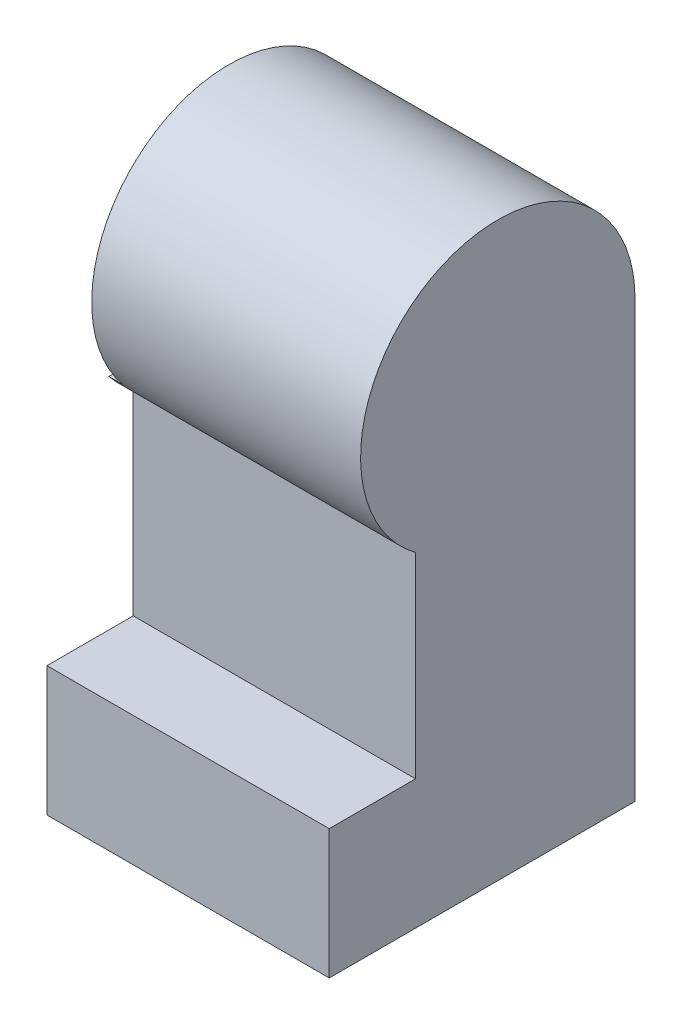
from build123d import *

# Parameters (mm, degrees)
SALIENTE_EXTRUIR1_DEPTH    = 10.8
CORTAR_EXTRUIR1_DEPTH      = 28.076558127
CORTAR_EXTRUIR1_DEPTH_BACK = 28.076558127
CROQUIS4_W                 = 1.025
CROQUIS4_H                 = 17.1
CORTAR_EXTRUIR2_DEPTH      = 33.246404838
CORTAR_EXTRUIR2_DEPTH_BACK = 5.4
CROQUIS5_R                 = 3


with BuildPart() as part:
    # Croquis2 → Saliente-Extruir1 (new, symmetric)
    with BuildSketch(Plane(origin=(0, 0, 0), x_dir=(0, 0, -1), z_dir=(1, 0, 0))):
        with BuildLine():
            Line((11.7, 11.4), (11.7, -21.9))
            Line((11.7, -21.9), (-11.7, -21.9))
            Line((-11.7, -21.9), (-11.7, -12))
            Line((-11.7, -12), (-5.1, -12))
            Line((-5.1, -12), (-5.1, 3))
            ThreePointArc((-5.1, 3), (-3.495742753, 20.791485505), (11.7, 11.4))
        make_face()
    extrude(amount=SALIENTE_EXTRUIR1_DEPTH, both=True)

    # Croquis4 → Cortar-Extruir1 (cut, two sides: drawn at the far end of the back side and taken through both)
    with BuildSketch(Plane.XY.offset(-CORTAR_EXTRUIR1_DEPTH_BACK)):
        with Locations((-10.2875, 13.35)):
            Rectangle(CROQUIS4_W, CROQUIS4_H)
    extrude(amount=CORTAR_EXTRUIR1_DEPTH + CORTAR_EXTRUIR1_DEPTH_BACK, mode=Mode.SUBTRACT)

    # Croquis5 → Cortar-Extruir2 (cut, two sides: drawn at the far end of the back side and taken through both)
    with BuildSketch(Plane.ZY.offset(9.775).offset(-CORTAR_EXTRUIR2_DEPTH_BACK)):
        with Locations(Location((0, 13.35, 0), (0, 0, 90))):
            Circle(CROQUIS5_R)
    extrude(amount=CORTAR_EXTRUIR2_DEPTH + CORTAR_EXTRUIR2_DEPTH_BACK, mode=Mode.SUBTRACT)


solid = part.part
